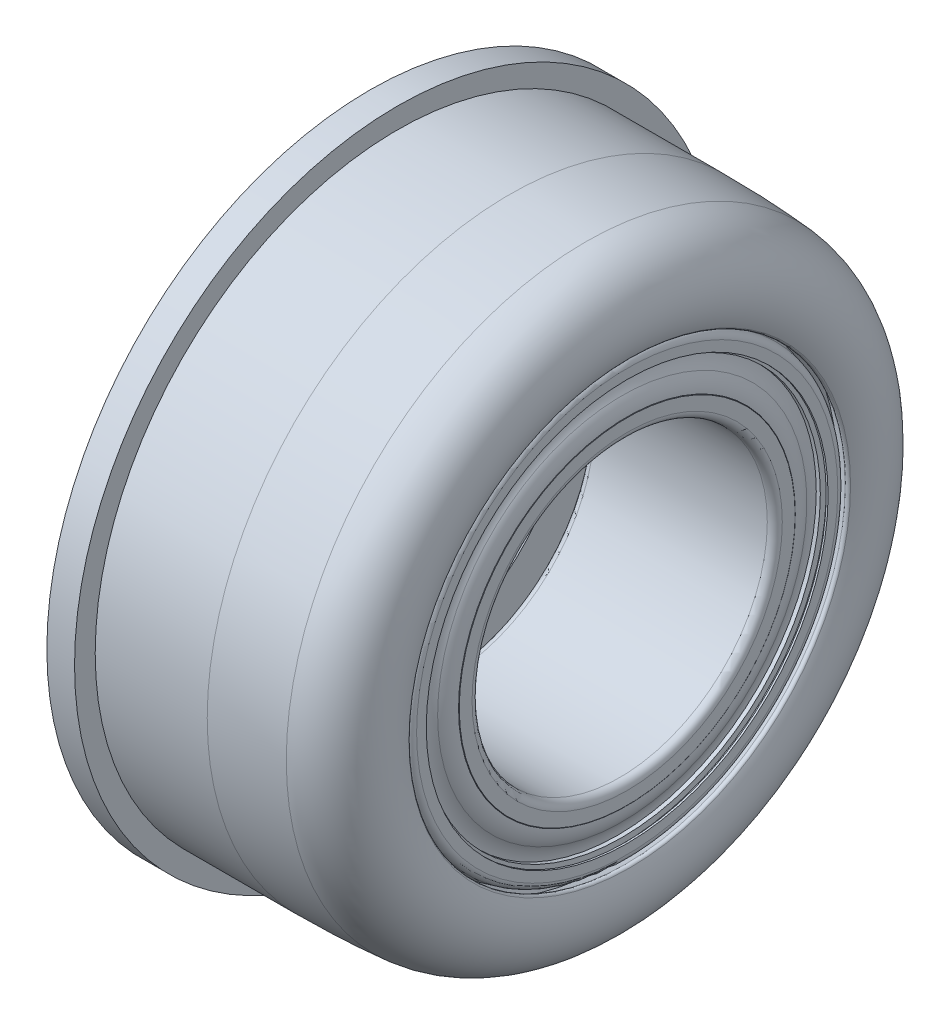
from build123d import *

# Parameters (mm, degrees)
O_RING_SKETCH_R                 = 0.76
SKETCH7_W                       = 2.286
SKETCH7_H                       = 0.6096
MIDDLE_RING_CUT_DEPTH           = 13.887396972
CUT_CIRCLE_PATTERN_COUNT        = 10
ROLLERBALL_CIRLCE_PATTERN_COUNT = 10
SKETCH11_W                      = 0.109447439
SKETCH11_H                      = 0.16


with BuildPart() as part:
    # External Body Sketch → External Component Revolve (revolve)
    with BuildSketch(Plane.XY):
        with BuildLine():
            Line((-2.85, 8.19), (-2.85, 8.75))
            Line((-2.85, 8.75), (-3.6, 8.75))
            Line((-3.6, 8.75), (-3.6, 4.377))
            Line((-3.6, 4.377), (-3.473, 4.25))
            Line((-3.473, 4.25), (-2.723, 4.25))
            Line((-2.723, 4.25), (-2.596, 4.377))
            Line((-2.596, 4.377), (-2.596, 5.75))
            Line((-2.596, 5.75), (-2.086, 5.75))
            Line((-2.086, 5.75), (-0.66, 6.15889892))
            Line((-0.66, 6.15889892), (-0.66, 6.258))
            Line((-0.66, 6.258), (1.03, 6.258))
            Line((1.03, 6.258), (1.489622698, 7.054089866))
            ThreePointArc((1.489622698, 7.054089866), (1.760740657, 7.318669485), (2.13, 7.403255888))
            ThreePointArc((2.13, 7.403255888), (2.667401154, 7.180657042), (2.89, 6.643255888))
            ThreePointArc((2.89, 6.643255888), (2.864103628, 6.446553414), (2.788179307, 6.263255888))
            Line((2.788179307, 6.263255888), (3.33177993, 5.949407922))
            ThreePointArc((3.33177993, 5.949407922), (3.394701508, 5.942044007), (3.443249278, 5.982743714))
            ThreePointArc((3.443249278, 5.982743714), (3.410808263, 7.364664368), (2.245823631, 8.108685821))
            ThreePointArc((2.245823631, 8.108685821), (1.21621361, 8.169663549), (0.185, 8.19))
            Line((0.185, 8.19), (-2.85, 8.19))
        make_face()
    revolve(axis=Axis((-3.6, 0, 0), (1, 0, 0)))


with BuildPart() as body_2:
    # Sketch6 → Internal Component Revolve (revolve)
    with BuildSketch(Plane.XY):
        with BuildLine():
            Line((-1.30595, 5.19016944), (0.245403558, 5.19016944))
            ThreePointArc((0.245403558, 5.19016944), (0.834, 5.54008472), (1.422596442, 5.19016944))
            Line((1.422596442, 5.19016944), (2.97395, 5.19016944))
            Line((2.97395, 5.19016944), (2.97395, 5.44416944))
            Line((2.97395, 5.44416944), (3.12395, 5.44416944))
            Line((3.12395, 5.44416944), (3.12395, 5.533972001))
            Line((3.12395, 5.533972001), (3.233397439, 5.533972001))
            Line((3.233397439, 5.533972001), (3.3232, 5.44416944))
            Line((3.3232, 5.44416944), (3.374, 5.44416944))
            Line((3.374, 5.44416944), (3.374, 5.705841064))
            ThreePointArc((3.374, 5.705841064), (3.333082736, 5.828129876), (3.226809511, 5.90116944))
            ThreePointArc((3.226809511, 5.90116944), (0.834, 6.237456886), (-1.558809511, 5.90116944))
            ThreePointArc((-1.558809511, 5.90116944), (-1.665082736, 5.828129876), (-1.706, 5.705841064))
            Line((-1.706, 5.705841064), (-1.706, 5.44416944))
            Line((-1.706, 5.44416944), (-1.6552, 5.44416944))
            Line((-1.6552, 5.44416944), (-1.565397439, 5.533972001))
            Line((-1.565397439, 5.533972001), (-1.45595, 5.533972001))
            Line((-1.45595, 5.533972001), (-1.45595, 5.44416944))
            Line((-1.45595, 5.44416944), (-1.30595, 5.44416944))
            Line((-1.30595, 5.44416944), (-1.30595, 5.19016944))
        make_face()
        with BuildLine():
            Line((-1.706, 4.55), (-1.706, 4.2032))
            ThreePointArc((-1.706, 4.2032), (-1.646484098, 4.059515902), (-1.5028, 4))
            Line((-1.5028, 4), (3.1708, 4))
            ThreePointArc((3.1708, 4), (3.314484098, 4.059515902), (3.374, 4.2032))
            Line((3.374, 4.2032), (3.374, 4.55))
            Line((3.374, 4.55), (3.233397439, 4.55))
            Line((3.233397439, 4.55), (3.233397439, 4.47))
            Line((3.233397439, 4.47), (3.12395, 4.47))
            Line((3.12395, 4.47), (3.12395, 4.55))
            Line((3.12395, 4.55), (1.422596442, 4.55))
            ThreePointArc((1.422596442, 4.55), (0.834, 4.20008472), (0.245403558, 4.55))
            Line((0.245403558, 4.55), (-1.45595, 4.55))
            Line((-1.45595, 4.55), (-1.45595, 4.47))
            Line((-1.45595, 4.47), (-1.565397439, 4.47))
            Line((-1.565397439, 4.47), (-1.565397439, 4.55))
            Line((-1.565397439, 4.55), (-1.706, 4.55))
        make_face()
    revolve(axis=Axis((-3.6, 0, 0), (1, 0, 0)))


with BuildPart() as body_3:
    # O-Ring Sketch → O-Ring (revolve)
    with BuildSketch(Plane.XY):
        with Locations((2.13, 6.643255888)):
            Circle(O_RING_SKETCH_R)
    revolve(axis=Axis((-3.6, 0, 0), (1, 0, 0)))


with BuildPart() as body_4:
    # Sketch7 → Middle Ring (revolve)
    with BuildSketch(Plane.XY):
        with Locations((0.834, 4.87008472)):
            Rectangle(SKETCH7_W, SKETCH7_H)
    revolve(axis=Axis((-3.6, 0, 0), (1, 0, 0)))

    # Sketch10 → Middle Ring Cut (cut, through all)
    with BuildSketch(Plane(origin=(0, 0, 0), x_dir=(1, 0, 0), z_dir=(0, 1, 0))):
        with BuildLine():
            Line((0.834, 0.67), (-3.6, 0.67))
            Line((-3.6, 0.67), (-3.6, -0.67))
            Line((-3.6, -0.67), (0.834, -0.67))
            ThreePointArc((0.834, -0.67), (1.504, 0), (0.834, 0.67))
        make_face()
    middle_ring_cut = extrude(amount=MIDDLE_RING_CUT_DEPTH, mode=Mode.SUBTRACT)

    # Cut Circle Pattern: Middle Ring Cut ×10 about axis
    cut_circle_pattern_axis = Axis((-3.6, 0, 0), (-1, 0, 0))
    for i in range(1, CUT_CIRCLE_PATTERN_COUNT):
        add(middle_ring_cut.rotate(cut_circle_pattern_axis, i * 360 / CUT_CIRCLE_PATTERN_COUNT), mode=Mode.SUBTRACT)


with BuildPart() as body_5:
    # Sketch8 → Rollerball (revolve)
    with BuildSketch(Plane.XY):
        with BuildLine():
            Line((0.834, 5.54008472), (0.834, 4.20008472))
            ThreePointArc((0.834, 4.20008472), (1.504, 4.87008472), (0.834, 5.54008472))
        make_face()
    revolve(axis=Axis((0.834, 5.54008472, 0), (0, -1, 0)))


with BuildPart() as rollerball_cirlce_pattern_1:
    # Rollerball Cirlce Pattern: pattern copy
    add(body_5.part.rotate(Axis((-3.6, 0, 0), (-1, 0, 0)), 1 * 360 / ROLLERBALL_CIRLCE_PATTERN_COUNT))


with BuildPart() as rollerball_cirlce_pattern_2:
    # Rollerball Cirlce Pattern: pattern copy
    add(body_5.part.rotate(Axis((-3.6, 0, 0), (-1, 0, 0)), 2 * 360 / ROLLERBALL_CIRLCE_PATTERN_COUNT))


with BuildPart() as rollerball_cirlce_pattern_3:
    # Rollerball Cirlce Pattern: pattern copy
    add(body_5.part.rotate(Axis((-3.6, 0, 0), (-1, 0, 0)), 3 * 360 / ROLLERBALL_CIRLCE_PATTERN_COUNT))


with BuildPart() as rollerball_cirlce_pattern_4:
    # Rollerball Cirlce Pattern: pattern copy
    add(body_5.part.rotate(Axis((-3.6, 0, 0), (-1, 0, 0)), 4 * 360 / ROLLERBALL_CIRLCE_PATTERN_COUNT))


with BuildPart() as rollerball_cirlce_pattern_5:
    # Rollerball Cirlce Pattern: pattern copy
    add(body_5.part.rotate(Axis((-3.6, 0, 0), (-1, 0, 0)), 5 * 360 / ROLLERBALL_CIRLCE_PATTERN_COUNT))


with BuildPart() as rollerball_cirlce_pattern_6:
    # Rollerball Cirlce Pattern: pattern copy
    add(body_5.part.rotate(Axis((-3.6, 0, 0), (-1, 0, 0)), 6 * 360 / ROLLERBALL_CIRLCE_PATTERN_COUNT))


with BuildPart() as rollerball_cirlce_pattern_7:
    # Rollerball Cirlce Pattern: pattern copy
    add(body_5.part.rotate(Axis((-3.6, 0, 0), (-1, 0, 0)), 7 * 360 / ROLLERBALL_CIRLCE_PATTERN_COUNT))


with BuildPart() as rollerball_cirlce_pattern_8:
    # Rollerball Cirlce Pattern: pattern copy
    add(body_5.part.rotate(Axis((-3.6, 0, 0), (-1, 0, 0)), 8 * 360 / ROLLERBALL_CIRLCE_PATTERN_COUNT))


with BuildPart() as rollerball_cirlce_pattern_9:
    # Rollerball Cirlce Pattern: pattern copy
    add(body_5.part.rotate(Axis((-3.6, 0, 0), (-1, 0, 0)), 9 * 360 / ROLLERBALL_CIRLCE_PATTERN_COUNT))


with BuildPart() as body_15:
    # Sketch11 → Shielded (revolve)
    with BuildSketch(Plane.XY):
        with Locations((3.178673719, 5.453972001)):
            Rectangle(SKETCH11_W, SKETCH11_H)
        with BuildLine():
            Line((2.98545, 5.43146944), (3.11245, 5.43146944))
            ThreePointArc((3.11245, 5.43146944), (3.144972703, 5.207478356), (3.239854862, 5.001986001))
            ThreePointArc((3.239854862, 5.001986001), (3.336116337, 4.791790327), (3.367198719, 4.5627))
            Line((3.367198719, 4.5627), (3.240198719, 4.5627))
            ThreePointArc((3.240198719, 4.5627), (3.209116337, 4.791790327), (3.112854862, 5.001986001))
            ThreePointArc((3.112854862, 5.001986001), (3.017972703, 5.207478356), (2.98545, 5.43146944))
        make_face()
        with Locations((-1.51067372, 5.453972001)):
            Rectangle(SKETCH11_W, SKETCH11_H)
        with BuildLine():
            Line((-1.31745, 5.43146944), (-1.44445, 5.43146944))
            ThreePointArc((-1.44445, 5.43146944), (-1.476972703, 5.207478356), (-1.571854862, 5.001986001))
            ThreePointArc((-1.571854862, 5.001986001), (-1.668116337, 4.791790327), (-1.699198719, 4.5627))
            Line((-1.699198719, 4.5627), (-1.572198719, 4.5627))
            ThreePointArc((-1.572198719, 4.5627), (-1.541116337, 4.791790327), (-1.444854862, 5.001986001))
            ThreePointArc((-1.444854862, 5.001986001), (-1.349972703, 5.207478356), (-1.31745, 5.43146944))
        make_face()
    revolve(axis=Axis((-3.6, 0, 0), (1, 0, 0)))


solid = Compound([part.part, body_2.part, body_3.part, body_4.part, body_5.part, rollerball_cirlce_pattern_1.part, rollerball_cirlce_pattern_2.part, rollerball_cirlce_pattern_3.part, rollerball_cirlce_pattern_4.part, rollerball_cirlce_pattern_5.part, rollerball_cirlce_pattern_6.part, rollerball_cirlce_pattern_7.part, rollerball_cirlce_pattern_8.part, rollerball_cirlce_pattern_9.part, body_15.part])
